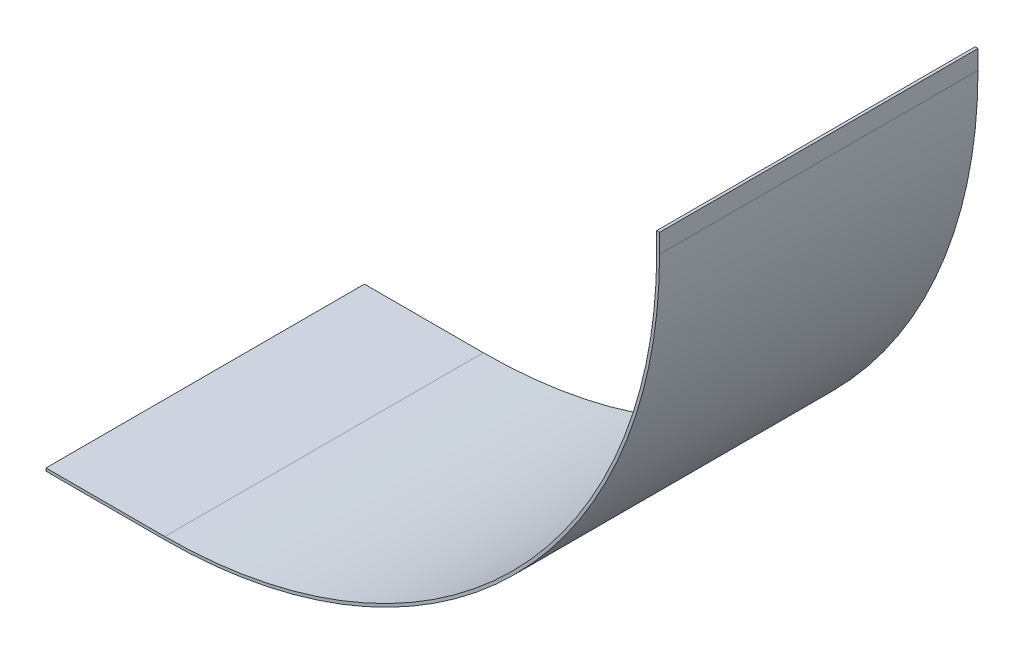
from build123d import *

# Parameters (mm, degrees)
EXTRUDE_THIN1_DEPTH = 670


with BuildPart() as part:
    # Sketch1 → Extrude-Thin1 (new body)
    with BuildSketch(Plane.XY):
        with BuildLine():
            Line((2235, -4410), (2235, -4450))
            ThreePointArc((2235, -4450), (1931.855518528, -5181.855518528), (1200, -5485))
            Line((1200, -5485), (950, -5485))
            Line((950, -5485), (950, -5491))
            Line((950, -5491), (1200, -5491))
            ThreePointArc((1200, -5491), (1936.098159215, -5186.098159215), (2241, -4450))
            Line((2241, -4450), (2241, -4410))
            Line((2241, -4410), (2235, -4410))
        make_face()
    extrude(amount=-EXTRUDE_THIN1_DEPTH)


solid = part.part
